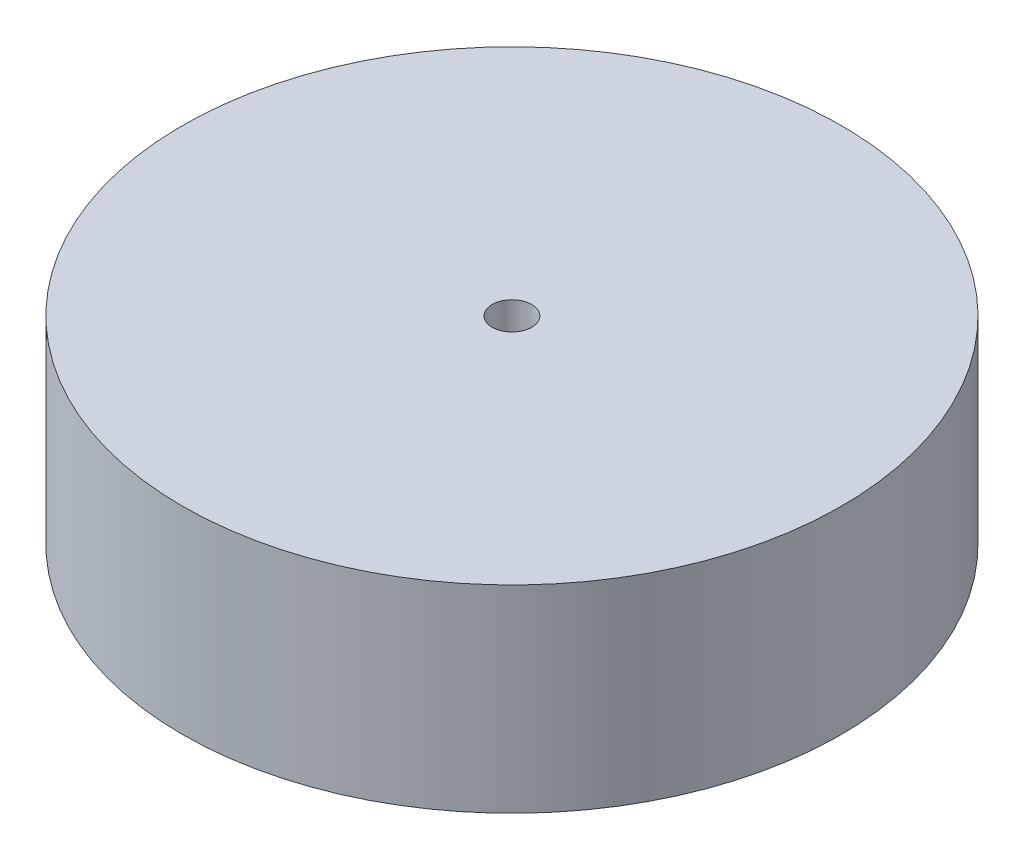
from build123d import *

# Parameters (mm, degrees)
SKETCH_1_R      = 50
SKETCH_1_R_2    = 3
EXTRUDE_1_DEPTH = 30


with BuildPart() as part:
    # Эскиз1 → Бобышка-Вытянуть1 (new body)
    with BuildSketch(Plane(origin=(0, 0, 0), x_dir=(1, 0, 0), z_dir=(0, 1, 0))):
        with Locations(Location((0, 0, 0), (0, 0, 270))):
            Circle(SKETCH_1_R)
        with Locations(Location((0, 0, 0), (0, 0, 270))):
            Circle(SKETCH_1_R_2, mode=Mode.SUBTRACT)
    extrude(amount=EXTRUDE_1_DEPTH)


solid = part.part
